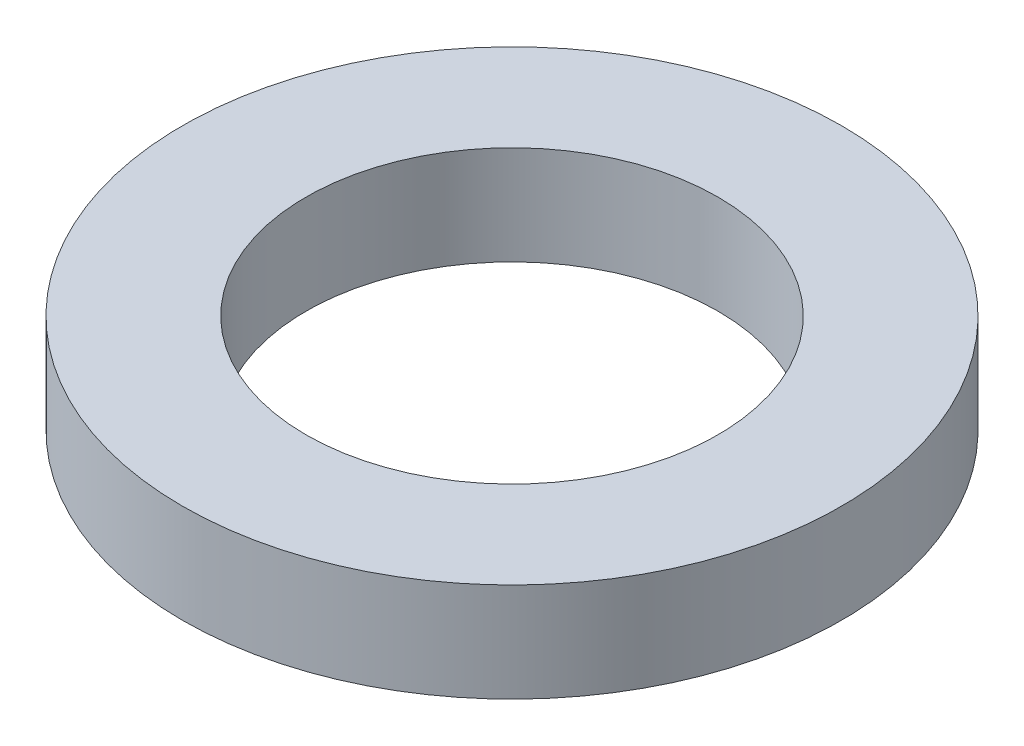
from build123d import *

# Parameters (mm, degrees)
SKETCH1_R           = 2
SKETCH1_R_2         = 1.25
BOSS_EXTRUDE1_DEPTH = 0.6


with BuildPart() as part:
    # Sketch1 → Boss-Extrude1 (new body)
    with BuildSketch(Plane(origin=(0, 0, 0), x_dir=(1, 0, 0), z_dir=(0, 1, 0))):
        with Locations(Location((0, 0, 0), (0, 0, 270))):
            Circle(SKETCH1_R)
        with Locations(Location((0, 0, 0), (0, 0, 270))):
            Circle(SKETCH1_R_2, mode=Mode.SUBTRACT)
    extrude(amount=BOSS_EXTRUDE1_DEPTH)


solid = part.part
